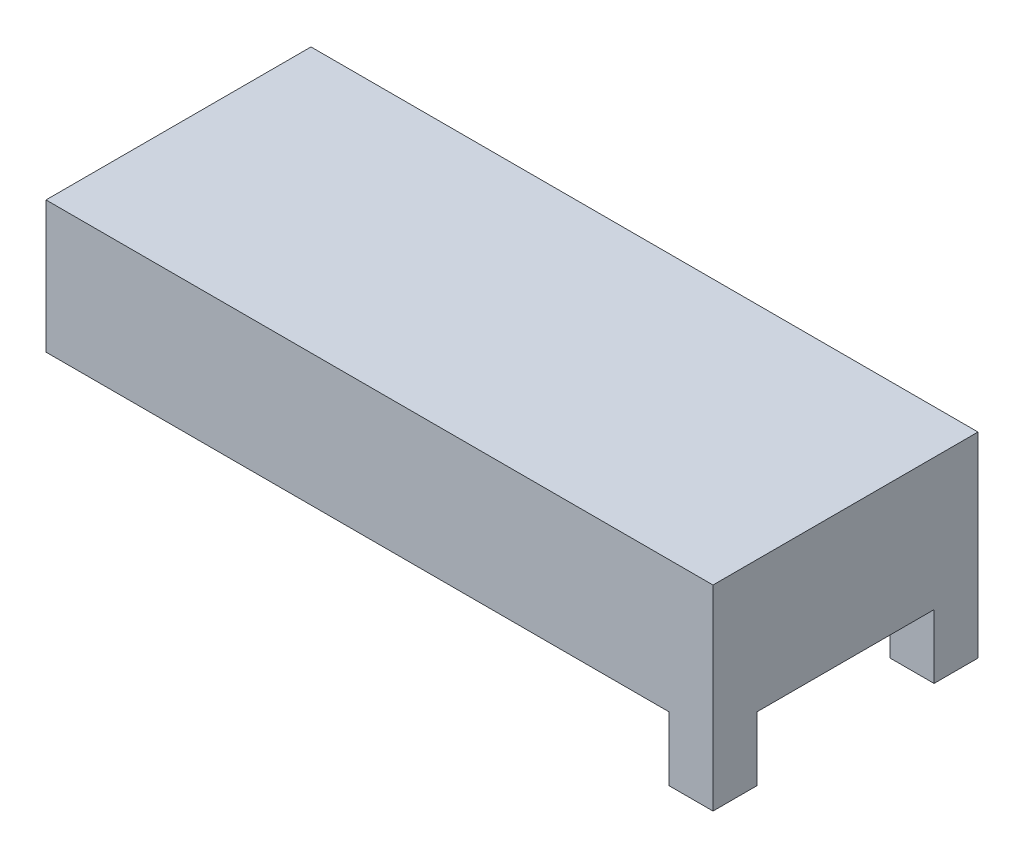
from build123d import *

# Parameters (mm, degrees)
SKETCH1_W           = 56.71
SKETCH1_H           = 24.12
BOSS_EXTRUDE1_DEPTH = 12
BOSS_EXTRUDE3_DEPTH = 4


with BuildPart() as part:
    # Sketch1 → Boss-Extrude1 (new body)
    with BuildSketch(Plane(origin=(0, 0, 0), x_dir=(1, 0, 0), z_dir=(0, 1, 0))):
        Rectangle(SKETCH1_W, SKETCH1_H)
    extrude(amount=BOSS_EXTRUDE1_DEPTH)

    # Sketch3 → Boss-Extrude3 (add)
    with BuildSketch(Plane(origin=(28.355, 0, 0), x_dir=(0, 0, -1), z_dir=(1, 0, 0))):
        Polygon((-12.06, 12), (-12.06, -5.821584267), (-8.06, -5.821584267), (-8.06, 0), (8.06, 0), (8.06, -5.821584267), (12.06, -5.821584267), (12.06, 12), align=None)
    extrude(amount=BOSS_EXTRUDE3_DEPTH)


solid = part.part
